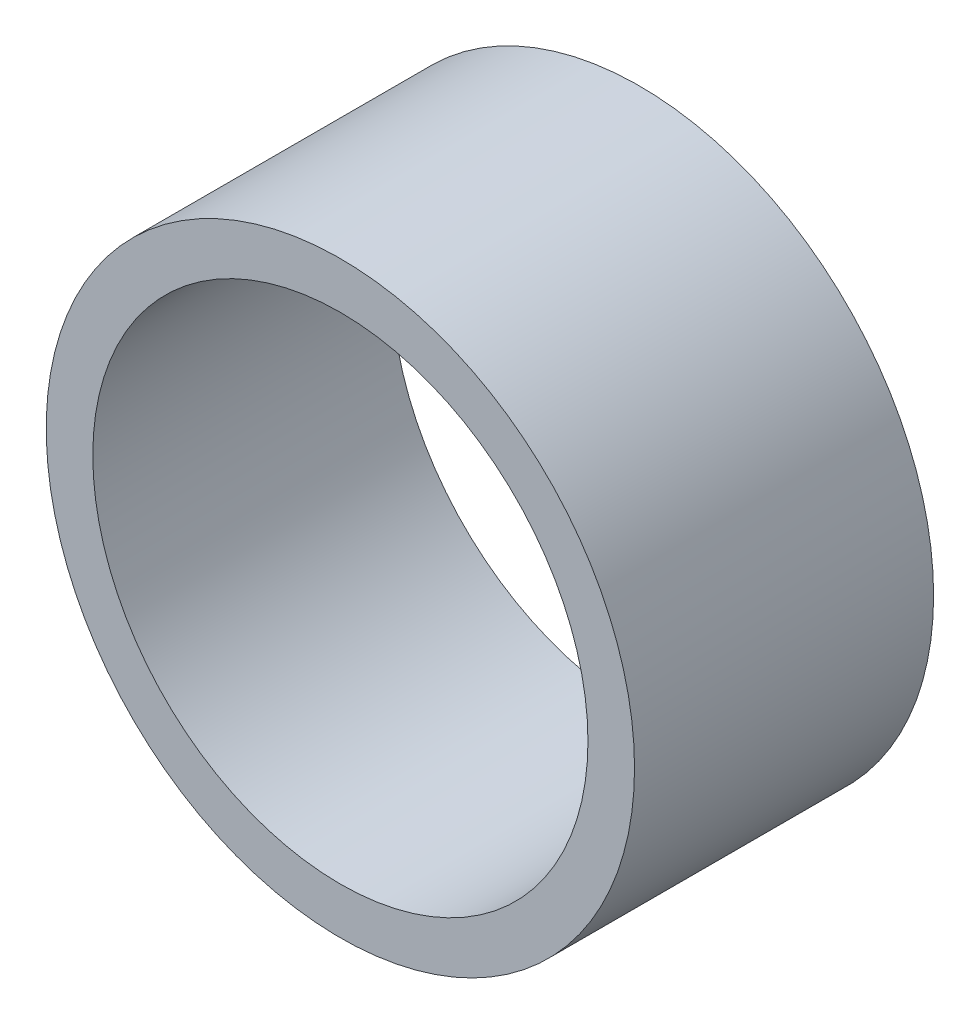
from build123d import *

# Parameters (mm, degrees)
SKETCH1_R           = 18
SKETCH1_R_2         = 15.15
BOSS_EXTRUDE1_DEPTH = 9.15


with BuildPart() as part:
    # Sketch1 → Boss-Extrude1 (new, symmetric)
    with BuildSketch(Plane.XY):
        Circle(SKETCH1_R)
        Circle(SKETCH1_R_2, mode=Mode.SUBTRACT)
    extrude(amount=BOSS_EXTRUDE1_DEPTH, both=True)


solid = part.part
